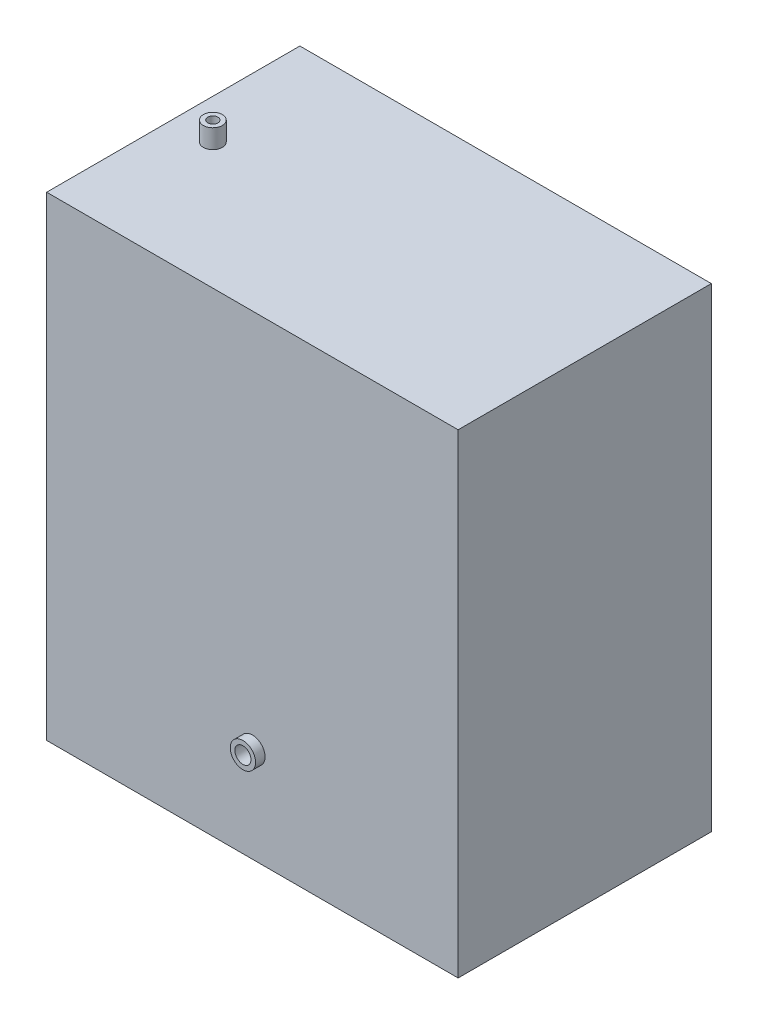
from build123d import *

# Parameters (mm, degrees)
SKETCH1_W          = 260
SKETCH1_H          = 160
TANK_BODY_DEPTH    = 300
INSIDE_START       = 297
SKETCH2_W          = 254
SKETCH2_H          = 154
INSIDE_DEPTH       = 294
INLET_PORT_START   = 300
SKETCH3_R          = 6
INLET_PORT_DEPTH   = 12
INLET_SOCKET_START = 312
SKETCH4_R          = 3.2
INLET_SOCKET_DEPTH = 10
INLET_HOLE_START   = 300
SKETCH5_R          = 2
INLET_HOLE_DEPTH   = 5
OUTLET_BOSS_START  = 80
SKETCH6_R          = 8
OUTLET_BOSS_DEPTH  = 6
TAP_SOCKET_START   = 86
SKETCH7_R          = 5.1
TAP_SOCKET_DEPTH   = 10


with BuildPart() as part:
    # Sketch1 → Tank_Body (new body)
    with BuildSketch(Plane(origin=(0, 0, 0), x_dir=(1, 0, 0), z_dir=(0, 1, 0))):
        Rectangle(SKETCH1_W, SKETCH1_H)
    extrude(amount=TANK_BODY_DEPTH)

    # Sketch2 → Inside (cut)
    with BuildSketch(Plane(origin=(0, 0, 0), x_dir=(1, 0, 0), z_dir=(0, 1, 0)).offset(INSIDE_START)):
        Rectangle(SKETCH2_W, SKETCH2_H)
    extrude(amount=-INSIDE_DEPTH, mode=Mode.SUBTRACT)

    # Sketch3 → Inlet_Port (add)
    with BuildSketch(Plane(origin=(0, 0, 0), x_dir=(1, 0, 0), z_dir=(0, 1, 0)).offset(INLET_PORT_START)):
        with Locations(Location((-105, 0, 0), (0, 0, 270))):
            Circle(SKETCH3_R)
    extrude(amount=INLET_PORT_DEPTH)

    # Sketch4 → Inlet_Socket (cut)
    with BuildSketch(Plane(origin=(0, 0, 0), x_dir=(1, 0, 0), z_dir=(0, 1, 0)).offset(INLET_SOCKET_START)):
        with Locations(Location((-105, 0, 0), (0, 0, 270))):
            Circle(SKETCH4_R)
    extrude(amount=-INLET_SOCKET_DEPTH, mode=Mode.SUBTRACT)

    # Sketch5 → Inlet_Hole (cut)
    with BuildSketch(Plane(origin=(0, 0, 0), x_dir=(1, 0, 0), z_dir=(0, 1, 0)).offset(INLET_HOLE_START)):
        with Locations(Location((-105, 0, 0), (0, 0, 270))):
            Circle(SKETCH5_R)
    extrude(amount=-INLET_HOLE_DEPTH, mode=Mode.SUBTRACT)

    # Sketch6 → Outlet_Boss (add)
    with BuildSketch(Plane.XY.offset(OUTLET_BOSS_START)):
        with Locations((0, 60)):
            Circle(SKETCH6_R)
    extrude(amount=OUTLET_BOSS_DEPTH)

    # Sketch7 → Tap_Socket (cut)
    with BuildSketch(Plane.XY.offset(TAP_SOCKET_START)):
        with Locations((0, 60)):
            Circle(SKETCH7_R)
    extrude(amount=-TAP_SOCKET_DEPTH, mode=Mode.SUBTRACT)


solid = part.part
